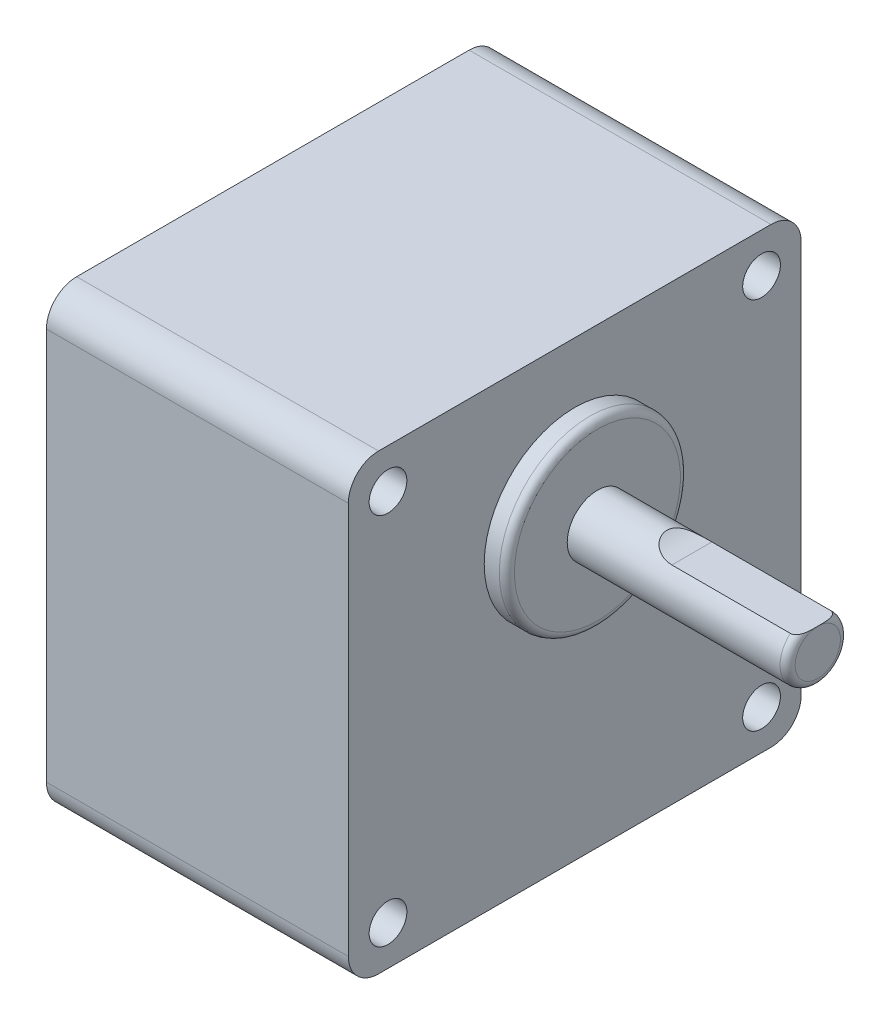
from build123d import *

# Parameters (mm, degrees)
SKETCH1_W               = 60
SKETCH1_H               = 60
BOSS_EXTRUDE1_DEPTH     = 40
SKETCH2_R               = 2.5
CUT_EXTRUDE1_DEPTH      = 65.031242374
FILLET1_R               = 4
FILLET2_R               = 1
CUT_EXTRUDE2_DEPTH      = 66.946948375
CUT_EXTRUDE2_DEPTH_BACK = 66.946948375
SKETCH5_W               = 2.5
SKETCH5_H               = 27


with BuildPart() as part:
    # Sketch1 → Boss-Extrude1 (new body)
    with BuildSketch(Plane(origin=(-3, 0, 0), x_dir=(0, 0, -1), z_dir=(1, 0, 0))):
        with Locations((0, -10)):
            Rectangle(SKETCH1_W, SKETCH1_H)
    extrude(amount=-BOSS_EXTRUDE1_DEPTH)

    # Sketch2 → Cut-Extrude1 (cut, through all)
    with BuildSketch(Plane(origin=(-3, 0, 0), x_dir=(0, 0, -1), z_dir=(1, 0, 0))):
        with Locations((-24.747474619, 14.75)):
            Circle(SKETCH2_R)
        with Locations((24.747474619, 14.75)):
            Circle(SKETCH2_R)
        with Locations((24.747474619, -34.75)):
            Circle(SKETCH2_R)
        with Locations((-24.747474619, -34.75)):
            Circle(SKETCH2_R)
    extrude(amount=-CUT_EXTRUDE1_DEPTH, mode=Mode.SUBTRACT)

    # Fillet1
    fillet1_edges = [part.edges().sort_by_distance(p)[0] for p in [
        (-23, 20, 30),
        (-23, 20, -30),
        (-23, -40, -30),
        (-23, -40, 30),
    ]]
    fillet(fillet1_edges, radius=FILLET1_R)

    # Sketch3 → Revolve1 (revolve)
    with BuildSketch(Plane.XY, mode=Mode.PRIVATE) as revolve1_sk:
        Polygon((-3, 12), (0, 12), (0, 4), (29.2, 4), (29.2, 0), (-3, 0), align=None)
    revolve(revolve1_sk.sketch.rotate(Axis((-3, 0, 0), (1, 0, 0)), 90), axis=Axis((-3, 0, 0), (1, 0, 0)))

    # Fillet2
    fillet2_edges = [part.edges().sort_by_distance(p)[0] for p in [
        (0, 0, -12),
        (29.2, 0, -4),
    ]]
    fillet(fillet2_edges, radius=FILLET2_R)

    # Sketch4 → Cut-Extrude2 (cut, two sides: drawn at the far end of the back side and taken through both)
    with BuildSketch(Plane.XY.offset(-CUT_EXTRUDE2_DEPTH_BACK)):
        with BuildLine():
            Line((29.2, 4), (9.2, 4))
            ThreePointArc((9.2, 4), (10.784573983, 3.255437353), (12.51662479, 3))
            Line((12.51662479, 3), (29.2, 3))
            Line((29.2, 3), (29.2, 4))
        make_face()
    extrude(amount=CUT_EXTRUDE2_DEPTH + CUT_EXTRUDE2_DEPTH_BACK, mode=Mode.SUBTRACT)

    # Sketch5 → Cut-Revolve1 (revolve, cut)
    with BuildSketch(Plane.XY, mode=Mode.PRIVATE) as cut_revolve1_sk:
        with Locations((-41.75, 3.5)):
            Rectangle(SKETCH5_W, SKETCH5_H)
    revolve(cut_revolve1_sk.sketch.rotate(Axis((-40.5, -10, 0), (-1, 0, 0)), 90), axis=Axis((-40.5, -10, 0), (-1, 0, 0)), mode=Mode.SUBTRACT)


solid = part.part
